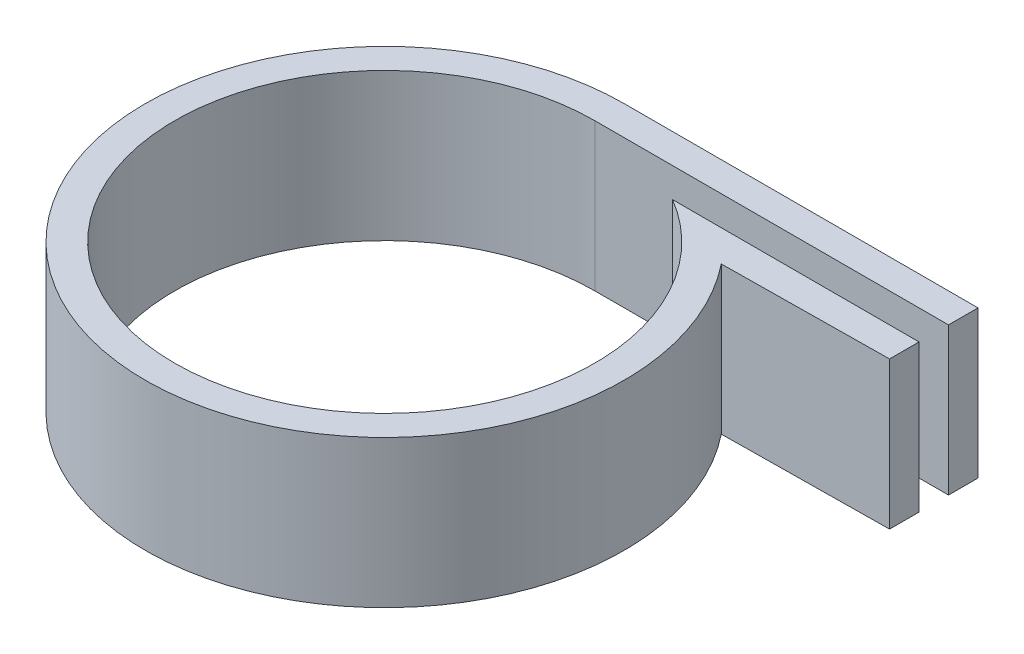
from build123d import *

# Parameters (mm, degrees)
BOSS_EXTRUDE1_DEPTH = 10


with BuildPart() as part:
    # Sketch1 → Boss-Extrude1 (new body)
    with BuildSketch(Plane(origin=(0, 0, 0), x_dir=(1, 0, 0), z_dir=(0, 1, 0))):
        with BuildLine():
            Line((7.280109889, 12.25), (24, 12.25))
            Line((24, 12.25), (24, 10.25))
            Line((24, 10.25), (12.712050634, 10.122562357))
            ThreePointArc((12.712050634, 10.122562357), (-7.055879169, -14.638205804), (0, 16.25))
            Line((0, 16.25), (24, 16.25))
            Line((24, 16.25), (24, 14.25))
            Line((24, 14.25), (0, 14.25))
            ThreePointArc((0, 14.25), (-3.774917218, -13.740906084), (7.280109889, 12.25))
        make_face()
    extrude(amount=BOSS_EXTRUDE1_DEPTH)


solid = part.part
